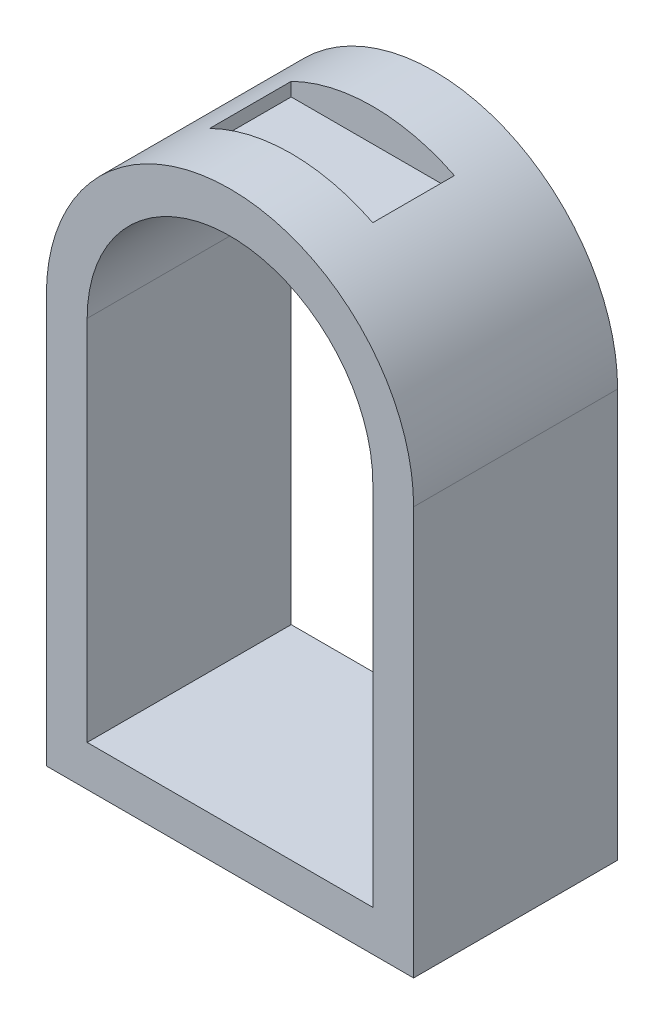
from build123d import *

# Parameters (mm, degrees)
BOSS_EXTRUDE1_DEPTH     = 127
CUT_EXTRUDE1_DEPTH      = 440.390634857
CUT_EXTRUDE1_DEPTH_BACK = 20.32
SKETCH2_W               = 101.6
SKETCH2_H               = 50.8


with BuildPart() as part:
    # Sketch1 → Boss-Extrude1 (new body)
    with BuildSketch(Plane.XY):
        with BuildLine():
            Line((-25.4, -25.4), (-25.4, 228.6))
            ThreePointArc((-25.4, 228.6), (88.9, 342.9), (203.2, 228.6))
            Line((203.2, 228.6), (203.2, -25.4))
            Line((203.2, -25.4), (-25.4, -25.4))
        make_face()
        with BuildLine():
            Line((0, 0), (177.8, 0))
            Line((177.8, 0), (177.8, 228.6))
            ThreePointArc((177.8, 228.6), (88.9, 317.5), (0, 228.6))
            Line((0, 228.6), (0, 0))
        make_face(mode=Mode.SUBTRACT)
    extrude(amount=BOSS_EXTRUDE1_DEPTH)

    # Sketch2 → Cut-Extrude1 (cut, two sides: drawn at the far end of the back side and taken through both)
    with BuildSketch(Plane(origin=(0, 342.9, 0), x_dir=(1, 0, 0), z_dir=(0, 1, 0)).offset(-CUT_EXTRUDE1_DEPTH_BACK)):
        with Locations((88.9, -63.5)):
            Rectangle(SKETCH2_W, SKETCH2_H)
    extrude(amount=CUT_EXTRUDE1_DEPTH + CUT_EXTRUDE1_DEPTH_BACK, mode=Mode.SUBTRACT)


solid = part.part
